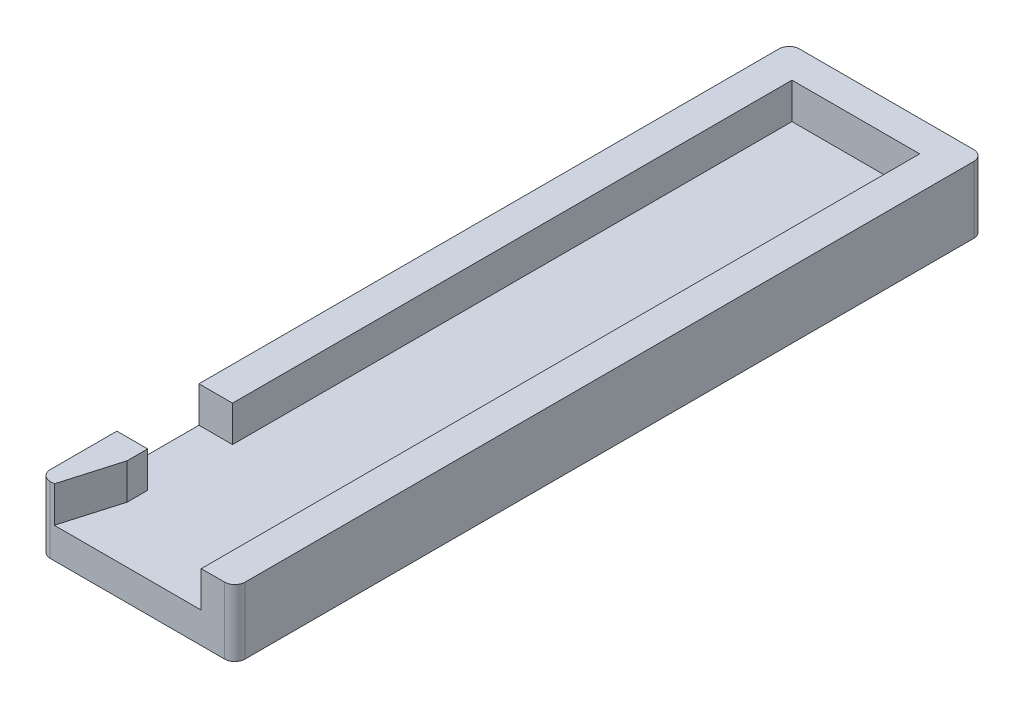
from build123d import *

# Parameters (mm, degrees)
EXTRUDE_1_DEPTH = 3
EXTRUDE_2_DEPTH = 3.5
FILLET_3_R      = 1


with BuildPart() as part:
    # ｽｹｯﾁ1 → ﾎﾞｽ - 押し出し1 (new body)
    with BuildSketch(Plane(origin=(0, 0, 0), x_dir=(1, 0, 0), z_dir=(0, 1, 0))):
        Polygon((0, 0), (7, 0), (12, 0), (19, 0), (19, 73.05), (0, 73.05), align=None)
    extrude(amount=EXTRUDE_1_DEPTH)

    # ｽｹｯﾁ2 → ﾎﾞｽ - 押し出し2 (add)
    with BuildSketch(Plane(origin=(0, 3, 0), x_dir=(1, 0, 0), z_dir=(0, 1, 0))):
        Polygon((1.4, 0), (3, 5.5), (3, 7.5), (0, 7.5), (0, 0), align=None)
        Polygon((0, 15.5), (3.275, 15.5), (3.275, 70.05), (15.725, 70.05), (15.725, 0), (19, 0), (19, 73.05), (0, 73.05), align=None)
    extrude(amount=EXTRUDE_2_DEPTH)

    # ﾌｨﾚｯﾄ3
    fillet_3_edges = [part.edges().sort_by_distance(p)[0] for p in [
        (0, 3.25, -73.05),
        (19, 3.25, -73.05),
        (19, 3.25, 0),
        (0, 3.25, 0),
    ]]
    fillet(fillet_3_edges, radius=FILLET_3_R)


solid = part.part
